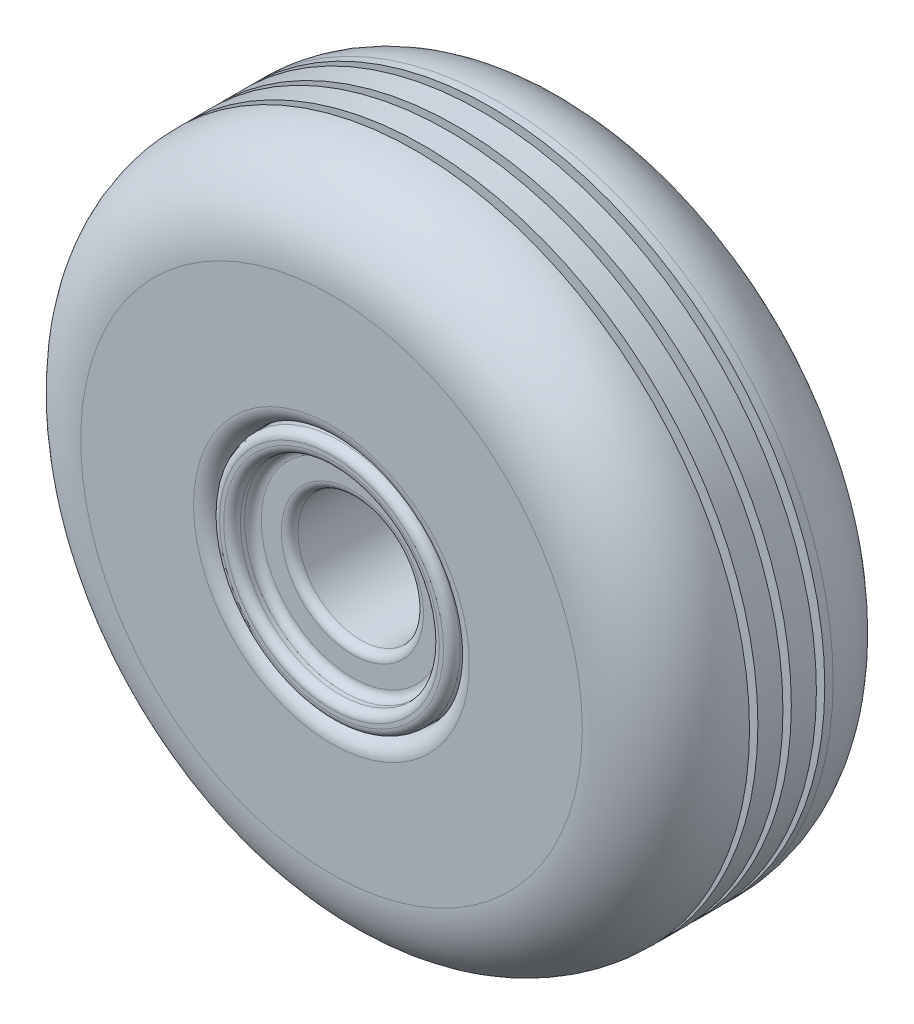
from build123d import *

# Parameters (mm, degrees)
CUT_EXTRUDE1_DEPTH      = 31.75
CUT_EXTRUDE1_DEPTH_BACK = 31.75
SKETCH3_R               = 19.05
FILLET1_R               = 2.54
FILLET2_R               = 5.08


with BuildPart() as part:
    # Sketch1 → Revolve1 (revolve)
    with BuildSketch(Plane(origin=(0, 0, 0), x_dir=(0, 0, -1), z_dir=(1, 0, 0)), mode=Mode.PRIVATE) as revolve1_sk:
        Polygon((-38.1, 36.576), (38.1, 36.576), (38.1, 30.226), (31.75, 30.226), (31.75, 0), (-31.75, 0), (-31.75, 30.226), (-38.1, 30.226), align=None)
    revolve(revolve1_sk.sketch.rotate(Axis((0, 0, 31.75), (0, 0, -1)), 90), axis=Axis((0, 0, 31.75), (0, 0, -1)))

    # Sketch3 → Cut-Extrude1 (cut, two sides: drawn at the far end of the back side and taken through both)
    with BuildSketch(Plane.XY.offset(-CUT_EXTRUDE1_DEPTH_BACK)):
        with Locations(Location((0, 0, 0), (0, 0, 180))):
            Circle(SKETCH3_R)
    extrude(amount=CUT_EXTRUDE1_DEPTH + CUT_EXTRUDE1_DEPTH_BACK, mode=Mode.SUBTRACT)

    # Fillet1
    fillet1_edges = [part.edges().sort_by_distance(p)[0] for p in [
        (19.05, 0, 31.75),
        (19.05, 0, -31.75),
        (-30.226, 0, 31.75),
        (-30.226, 0, 38.1),
        (-36.576, 0, 38.1),
        (-36.576, 0, -38.1),
        (-30.226, 0, -38.1),
        (-30.226, 0, -31.75),
    ]]
    fillet(fillet1_edges, radius=FILLET1_R)


with BuildPart() as body_2:
    # Sketch2 → Revolve2 (revolve)
    with BuildSketch(Plane(origin=(0, 0, 0), x_dir=(0, 0, -1), z_dir=(1, 0, 0)), mode=Mode.PRIVATE) as revolve2_sk:
        with BuildLine():
            Line((-12.7, 101.6), (-12.7, 97.184028038))
            Line((-12.7, 97.184028038), (-10.16, 97.184028038))
            Line((-10.16, 97.184028038), (-10.16, 101.6))
            Line((-10.16, 101.6), (-2.54, 101.6))
            Line((-2.54, 101.6), (-2.54, 97.184028038))
            Line((-2.54, 97.184028038), (0, 97.184028038))
            Line((0, 97.184028038), (0, 101.6))
            Line((0, 101.6), (7.62, 101.6))
            Line((7.62, 101.6), (7.62, 97.184028038))
            Line((7.62, 97.184028038), (10.16, 97.184028038))
            Line((10.16, 97.184028038), (10.16, 101.6))
            Line((10.16, 101.6), (12.7, 101.6))
            ThreePointArc((12.7, 101.6), (30.660512242, 94.160512242), (38.1, 76.2))
            Line((38.1, 76.2), (38.1, 36.83))
            Line((38.1, 36.83), (-38.1, 36.83))
            Line((-38.1, 36.83), (-38.1, 76.2))
            ThreePointArc((-38.1, 76.2), (-30.660512242, 94.160512242), (-12.7, 101.6))
        make_face()
    revolve(revolve2_sk.sketch.rotate(Axis((0, 0, 0), (0, 0, -1)), 90), axis=Axis((0, 0, 0), (0, 0, -1)))

    # Fillet2
    fillet2_edges = [body_2.edges().sort_by_distance(p)[0] for p in [
        (-36.83, 0, -38.1),
        (-36.83, 0, 38.1),
    ]]
    fillet(fillet2_edges, radius=FILLET2_R)


solid = Compound([part.part, body_2.part])
